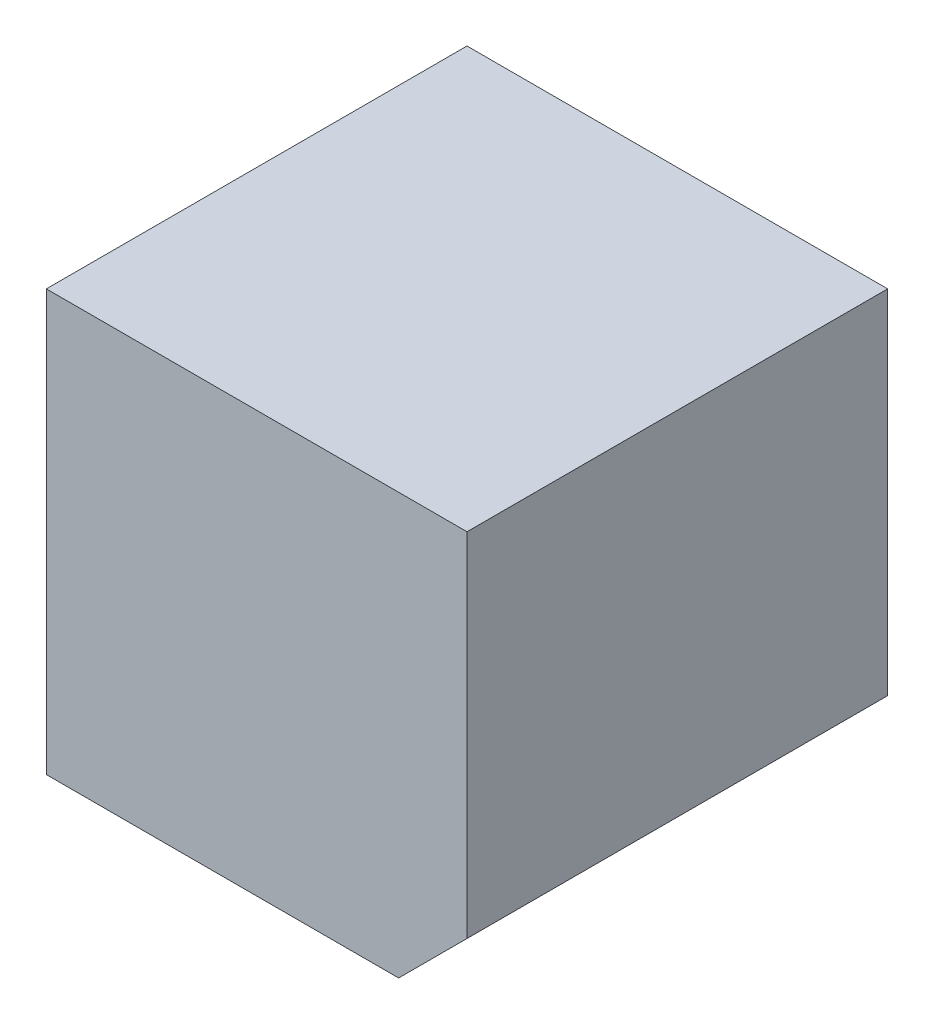
from build123d import *

# Parameters (mm, degrees)
BOSS_EXTRU_1_DEPTH      = 80
ENL_V_MAT_EXTRU_1_DEPTH = 78


with BuildPart() as part:
    # Esquisse1 → Boss.-Extru.1 (new body)
    with BuildSketch(Plane.XY):
        Polygon((27, -40), (40, -27), (40, 40), (-40, 40), (-40, -40), align=None)
    extrude(amount=BOSS_EXTRU_1_DEPTH)

    # Esquisse2 → Enlèv. mat.-Extru.1 (cut)
    with BuildSketch(Plane(origin=(0, 0, 0), x_dir=(-1, 0, 0), z_dir=(0, 0, -1))):
        Polygon((-38, -26.171572875), (-26.171572875, -38), (38, -38), (38, 38), (-38, 38), align=None)
    extrude(amount=-ENL_V_MAT_EXTRU_1_DEPTH, mode=Mode.SUBTRACT)


solid = part.part
